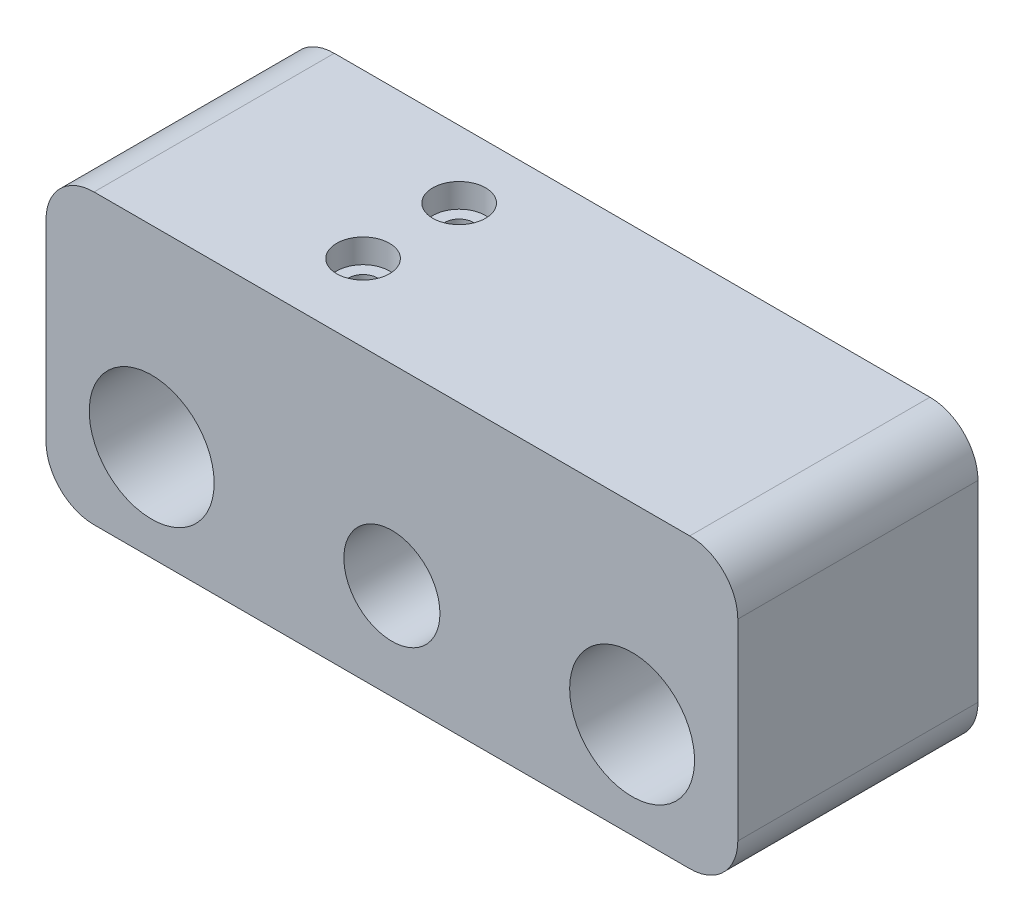
from build123d import *

# Parameters (mm, degrees)
SKETCH1_W           = 144
SKETCH1_H           = 80
BOSS_EXTRUDE1_DEPTH = 50
CUT_EXTRUDE1_REACH  = 98.354
SKETCH2_R           = 10
SKETCH2_R_2         = 13
CUT_EXTRUDE3_REACH  = 98.354
SKETCH3_W           = 144
SKETCH3_H           = 20
CUT_EXTRUDE4_REACH  = 108.226
SKETCH5_R           = 3
FILLET1_R           = 10
FILLET2_R           = 10
FILLET3_R           = 10
FILLET4_R           = 10
SKETCH6_R           = 5.5
CUT_EXTRUDE5_DEPTH  = 5


with BuildPart() as part:
    # Sketch1 → Boss-Extrude1 (new body)
    with BuildSketch(Plane.XY):
        Rectangle(SKETCH1_W, SKETCH1_H)
    extrude(amount=BOSS_EXTRUDE1_DEPTH)

    # Sketch2 → Cut-Extrude1 (cut, up to next)
    with BuildSketch(Plane.XY.offset(50), mode=Mode.PRIVATE) as cut_extrude1_sk1:
        Circle(SKETCH2_R)
    cut_extrude1_tool1 = extrude(cut_extrude1_sk1.sketch, amount=-CUT_EXTRUDE1_REACH, mode=Mode.PRIVATE) & part.part
    # Sketch2 → Cut-Extrude1 (cut, up to next)
    with BuildSketch(Plane.XY.offset(50), mode=Mode.PRIVATE) as cut_extrude1_sk2:
        with Locations((-50, 0)):
            Circle(SKETCH2_R_2)
    cut_extrude1_tool2 = extrude(cut_extrude1_sk2.sketch, amount=-CUT_EXTRUDE1_REACH, mode=Mode.PRIVATE) & part.part
    # Sketch2 → Cut-Extrude1 (cut, up to next)
    with BuildSketch(Plane.XY.offset(50), mode=Mode.PRIVATE) as cut_extrude1_sk3:
        with Locations(Location((50, 0, 0), (0, 0, 180))):
            Circle(SKETCH2_R_2)
    cut_extrude1_tool3 = extrude(cut_extrude1_sk3.sketch, amount=-CUT_EXTRUDE1_REACH, mode=Mode.PRIVATE) & part.part
    add(cut_extrude1_tool1.solids().sort_by_distance((0, 0, 50))[0], mode=Mode.SUBTRACT)
    add(cut_extrude1_tool2.solids().sort_by_distance((-50, 0, 50))[0], mode=Mode.SUBTRACT)
    add(cut_extrude1_tool3.solids().sort_by_distance((50, 0, 50))[0], mode=Mode.SUBTRACT)

    # Sketch3 → Cut-Extrude3 (cut, up to next)
    with BuildSketch(Plane.XY.offset(50), mode=Mode.PRIVATE) as cut_extrude3_sk1:
        with Locations((0, -30)):
            Rectangle(SKETCH3_W, SKETCH3_H)
    cut_extrude3_tool1 = extrude(cut_extrude3_sk1.sketch, amount=-CUT_EXTRUDE3_REACH, mode=Mode.PRIVATE) & part.part
    add(cut_extrude3_tool1.solids().sort_by_distance((0, -30, 50))[0], mode=Mode.SUBTRACT)

    # Sketch5 → Cut-Extrude4 (cut, up to next)
    with BuildSketch(Plane.XZ.offset(20), mode=Mode.PRIVATE) as cut_extrude4_sk1:
        with Locations(Location((-22, 34, 0), (0, 0, 270))):
            Circle(SKETCH5_R)
    cut_extrude4_tool1 = extrude(cut_extrude4_sk1.sketch, amount=-CUT_EXTRUDE4_REACH, mode=Mode.PRIVATE) & part.part
    # Sketch5 → Cut-Extrude4 (cut, up to next)
    with BuildSketch(Plane.XZ.offset(20), mode=Mode.PRIVATE) as cut_extrude4_sk2:
        with Locations(Location((-22, 14, 0), (0, 0, 270))):
            Circle(SKETCH5_R)
    cut_extrude4_tool2 = extrude(cut_extrude4_sk2.sketch, amount=-CUT_EXTRUDE4_REACH, mode=Mode.PRIVATE) & part.part
    add(cut_extrude4_tool1.solids().sort_by_distance((-22, -20, 34))[0], mode=Mode.SUBTRACT)
    add(cut_extrude4_tool2.solids().sort_by_distance((-22, -20, 14))[0], mode=Mode.SUBTRACT)

    # Fillet1
    fillet1_edges = [part.edges().sort_by_distance(p)[0] for p in [
        (72, -20, 25),
    ]]
    fillet(fillet1_edges, radius=FILLET1_R)

    # Fillet2
    fillet2_edges = [part.edges().sort_by_distance(p)[0] for p in [
        (72, 40, 25),
    ]]
    fillet(fillet2_edges, radius=FILLET2_R)

    # Fillet3
    fillet3_edges = [part.edges().sort_by_distance(p)[0] for p in [
        (-72, 40, 25),
    ]]
    fillet(fillet3_edges, radius=FILLET3_R)

    # Fillet4
    fillet4_edges = [part.edges().sort_by_distance(p)[0] for p in [
        (-72, -20, 25),
    ]]
    fillet(fillet4_edges, radius=FILLET4_R)

    # Sketch6 → Cut-Extrude5 (cut)
    with BuildSketch(Plane(origin=(0, 40, 0), x_dir=(1, 0, 0), z_dir=(0, 1, 0))):
        with Locations(Location((-22, -14, 0), (0, 0, 270))):
            Circle(SKETCH6_R)
        with Locations(Location((-22, -34, 0), (0, 0, 270))):
            Circle(SKETCH6_R)
    extrude(amount=-CUT_EXTRUDE5_DEPTH, mode=Mode.SUBTRACT)


solid = part.part
